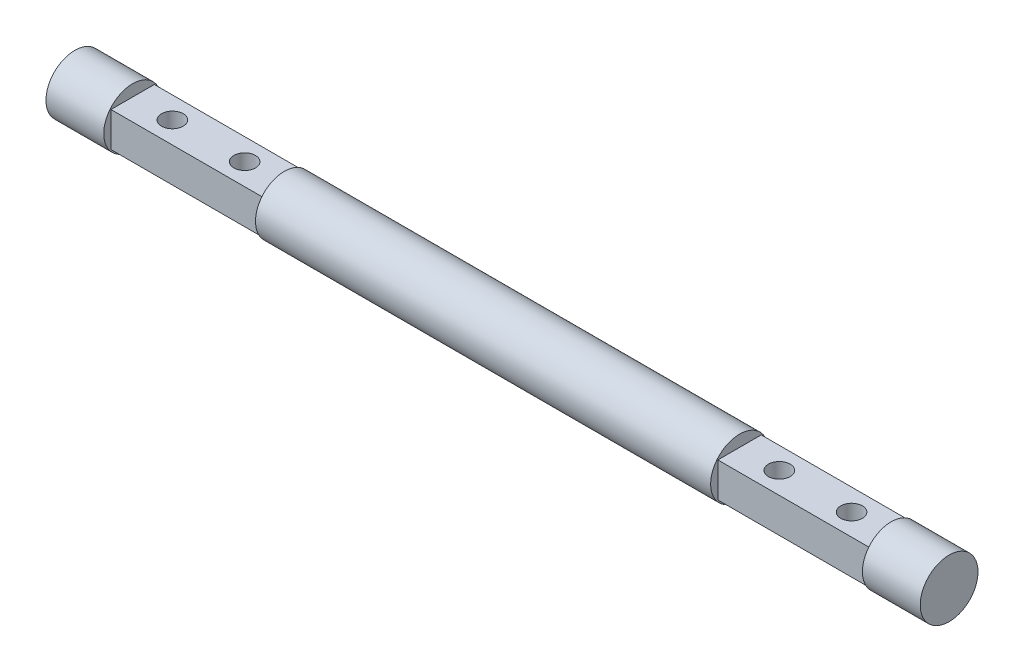
from build123d import *

# Parameters (mm, degrees)
SKETCH1_R           = 4
BOSS_EXTRUDE1_DEPTH = 31.5
SKETCH2_W           = 6
SKETCH2_H           = 4.8
BOSS_EXTRUDE2_DEPTH = 21
SKETCH3_R           = 4
BOSS_EXTRUDE3_DEPTH = 8
SKETCH4_R           = 1.5
CUT_EXTRUDE1_DEPTH  = 61.968926512


with BuildPart() as part:
    # Sketch1 → Boss-Extrude1 (new body)
    with BuildSketch(Plane(origin=(0, 0, 0), x_dir=(0, 0, -1), z_dir=(1, 0, 0))):
        Circle(SKETCH1_R)
    boss_extrude1 = extrude(amount=BOSS_EXTRUDE1_DEPTH)

    # Sketch2 → Boss-Extrude2 (add)
    with BuildSketch(Plane(origin=(31.5, 0, 0), x_dir=(0, 0, -1), z_dir=(1, 0, 0))):
        Rectangle(SKETCH2_W, SKETCH2_H)
    boss_extrude2 = extrude(amount=BOSS_EXTRUDE2_DEPTH)

    # Sketch3 → Boss-Extrude3 (add)
    with BuildSketch(Plane(origin=(52.5, 0, 0), x_dir=(0, 0, -1), z_dir=(1, 0, 0))):
        Circle(SKETCH3_R)
    boss_extrude3 = extrude(amount=BOSS_EXTRUDE3_DEPTH)

    # Mirror1: Boss-Extrude1, Boss-Extrude2, Boss-Extrude3 across plane
    add(boss_extrude1.mirror(Plane(origin=(0, 0, 0), x_dir=(0, 0, 1), z_dir=(1, 0, 0))))
    add(boss_extrude2.mirror(Plane(origin=(0, 0, 0), x_dir=(0, 0, 1), z_dir=(1, 0, 0))))
    add(boss_extrude3.mirror(Plane(origin=(0, 0, 0), x_dir=(0, 0, 1), z_dir=(1, 0, 0))))

    # Sketch4 → Cut-Extrude1 (cut, through all)
    with BuildSketch(Plane(origin=(0, 2.4, 0), x_dir=(1, 0, 0), z_dir=(0, 1, 0))):
        with Locations((-47, 0)):
            Circle(SKETCH4_R)
        with Locations((-37, 0)):
            Circle(SKETCH4_R)
        with Locations((47, 0)):
            Circle(SKETCH4_R)
        with Locations((37, 0)):
            Circle(SKETCH4_R)
    extrude(amount=-CUT_EXTRUDE1_DEPTH, mode=Mode.SUBTRACT)


solid = part.part
